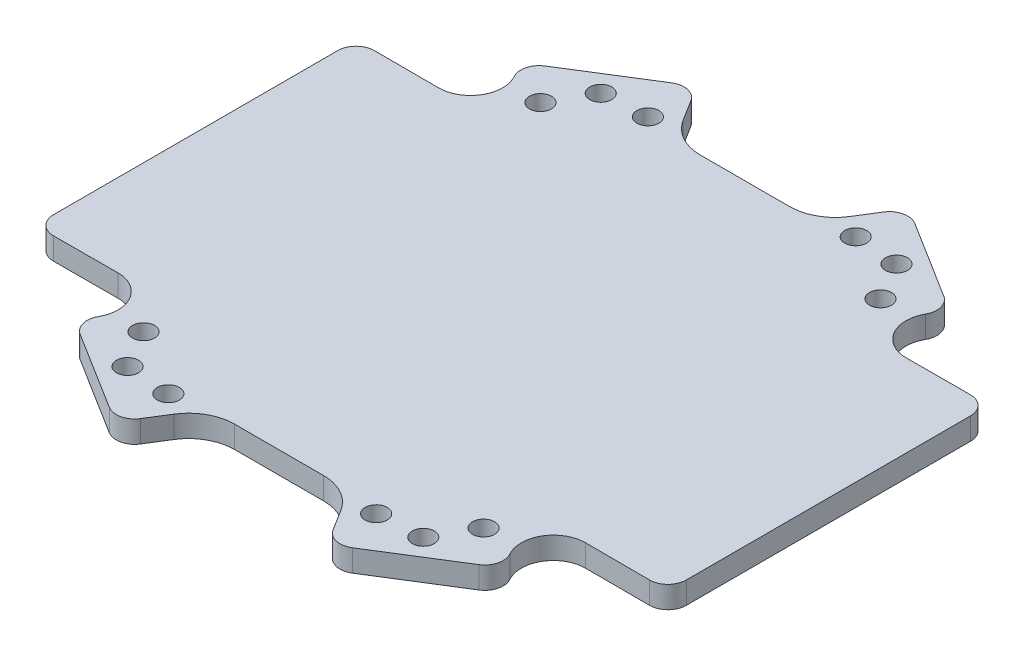
from build123d import *

# Parameters (mm, degrees)
BOSS_EXTRUDE1_DEPTH     = 1.2
FILLET1_R               = 3.5
FILLET2_R               = 5
FILLET3_R               = 2
SKETCH3_R               = 1.2
CUT_EXTRUDE1_DEPTH      = 47.412929356
MIRROR2_COPY_1_SKETCH_R = 1.2
MIRROR2_COPY_1_DEPTH    = 47.412929356


with BuildPart() as part:
    # Sketch2 → Boss-Extrude1 (new, symmetric)
    with BuildSketch(Plane(origin=(0, 0, 0), x_dir=(1, 0, 0), z_dir=(0, 1, 0))):
        Polygon((-34.5, -17.5), (-34.5, 17.5), (-19.164918189, 17.456295518), (-23.435988128, 24.29000742), (-11.564011872, 31.70999258), (-7.623299146, 25.404852218), (7.623299146, 25.404852218), (11.564011872, 31.70999258), (23.435988128, 24.29000742), (19.164918189, 17.456295518), (34.5, 17.5), (34.5, -17.5), (19.164918189, -17.456295518), (23.435988128, -24.29000742), (11.564011872, -31.70999258), (7.623299146, -25.404852218), (-7.623299146, -25.404852218), (-11.564011872, -31.70999258), (-23.435988128, -24.29000742), (-19.164918189, -17.456295518), align=None)
    extrude(amount=BOSS_EXTRUDE1_DEPTH, both=True)

    # Fillet1
    fillet1_edges = [part.edges().sort_by_distance(p)[0] for p in [
        (-19.164918189, 0, -17.456295518),
        (19.164918189, 0, -17.456295518),
        (19.164918189, 0, 17.456295518),
        (-19.164918189, 0, 17.456295518),
    ]]
    fillet(fillet1_edges, radius=FILLET1_R)

    # Fillet2
    fillet2_edges = [part.edges().sort_by_distance(p)[0] for p in [
        (-7.623299146, 0, -25.404852218),
        (7.623299146, 0, -25.404852218),
        (7.623299146, 0, 25.404852218),
        (-7.623299146, 0, 25.404852218),
    ]]
    fillet(fillet2_edges, radius=FILLET2_R)

    # Fillet3
    fillet3_edges = [part.edges().sort_by_distance(p)[0] for p in [
        (34.5, 0, -17.5),
        (23.435988128, 0, -24.29000742),
        (34.5, 0, 17.5),
        (23.435988128, 0, 24.29000742),
        (11.564011872, 0, 31.70999258),
        (11.564011872, 0, -31.70999258),
        (-11.564011872, 0, -31.70999258),
        (-23.435988128, 0, -24.29000742),
        (-34.5, 0, -17.5),
        (-34.5, 0, 17.5),
        (-11.564011872, 0, 31.70999258),
        (-23.435988128, 0, 24.29000742),
    ]]
    fillet(fillet3_edges, radius=FILLET3_R)

    # Sketch3 → Cut-Extrude1 (cut, through all)
    with BuildSketch(Plane(origin=(0, 1.2, 0), x_dir=(1, 0, 0), z_dir=(0, 1, 0))):
        with Locations(Location((-16.127132138, 25.803411421, 0), (0, 0, 270))):
            Circle(SKETCH3_R)
        with Locations(Location((-11.330641731, 26.147910732, 0), (0, 0, 270))):
            Circle(SKETCH3_R)
        with Locations(Location((-18.538627315, 21.642919742, 0), (0, 0, 270))):
            Circle(SKETCH3_R)
    cut_extrude1 = extrude(amount=-CUT_EXTRUDE1_DEPTH, mode=Mode.SUBTRACT)

    # Mirror1: Cut-Extrude1 across plane
    add(cut_extrude1.mirror(Plane(origin=(0, 0, 0), x_dir=(0, 0, 1), z_dir=(1, 0, 0))), mode=Mode.SUBTRACT)

    # Mirror2: Cut-Extrude1 across plane
    add(cut_extrude1.mirror(Plane.XY), mode=Mode.SUBTRACT)

    # Mirror2 copy 1 sketch → Mirror2 copy 1 (cut, through all)
    with BuildSketch(Plane(origin=(0, 1.2, 0), x_dir=(-1, 0, 0), z_dir=(0, 1, 0))):
        with Locations(Location((-16.127132138, 25.803411421, 0), (0, 0, 270))):
            Circle(MIRROR2_COPY_1_SKETCH_R)
        with Locations(Location((-11.330641731, 26.147910732, 0), (0, 0, 270))):
            Circle(MIRROR2_COPY_1_SKETCH_R)
        with Locations(Location((-18.538627315, 21.642919742, 0), (0, 0, 270))):
            Circle(MIRROR2_COPY_1_SKETCH_R)
    extrude(amount=-MIRROR2_COPY_1_DEPTH, mode=Mode.SUBTRACT)


solid = part.part
